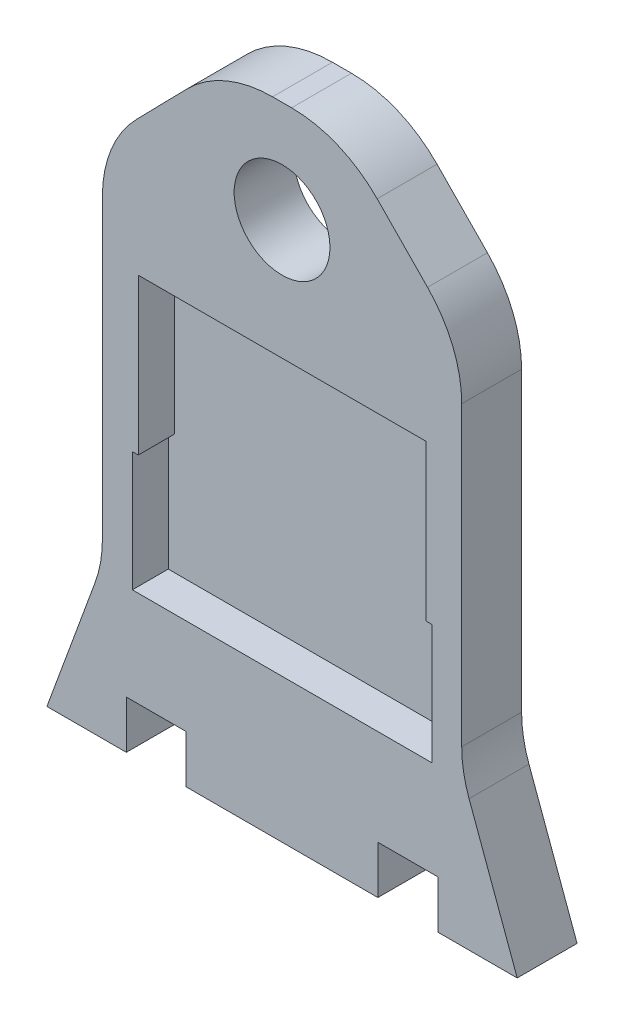
from build123d import *

# Parameters (mm, degrees)
ESQUISSE1_W             = 30
ESQUISSE1_H             = 67
ESQUISSE1_R             = 4
BOSS_EXTRU_1_DEPTH      = 5
ESQUISSE2_W             = 30
ESQUISSE2_H             = 12.5
ENL_V_MAT_EXTRU_1_DEPTH = 5
ESQUISSE3_W             = 5
ESQUISSE3_H             = 5
ENL_V_MAT_EXTRU_2_DEPTH = 38.043892884
BOSS_EXTRU_2_DEPTH      = 5
ENL_V_MAT_EXTRU_3_DEPTH = 40.33509883
ESQUISSE8_W             = 41.113396405
ESQUISSE8_H             = 1
ENL_V_MAT_EXTRU_4_DEPTH = 40.33509883
CONG_1_R                = 10
CONG_2_R                = 10
ESQUISSE9_W             = 24
ESQUISSE9_H             = 13
ENL_V_MAT_EXTRU_5_DEPTH = 3


with BuildPart() as part:
    # Esquisse1 → Boss.-Extru.1 (new body)
    with BuildSketch(Plane.XY):
        Rectangle(ESQUISSE1_W, ESQUISSE1_H)
        with Locations((0, 12.5)):
            Circle(ESQUISSE1_R, mode=Mode.SUBTRACT)
    extrude(amount=BOSS_EXTRU_1_DEPTH)

    # Esquisse2 → Enlèv. mat.-Extru.1 (cut)
    with BuildSketch(Plane.XY.offset(5)):
        with Locations((0, 27.25)):
            Rectangle(ESQUISSE2_W, ESQUISSE2_H)
    extrude(amount=-ENL_V_MAT_EXTRU_1_DEPTH, mode=Mode.SUBTRACT)

    # Esquisse3 → Enlèv. mat.-Extru.2 (cut, through all)
    with BuildSketch(Plane.XY.offset(5)):
        with Locations((-10.5, -31)):
            Rectangle(ESQUISSE3_W, ESQUISSE3_H)
        with Locations((10.5, -31)):
            Rectangle(ESQUISSE3_W, ESQUISSE3_H)
    extrude(amount=-ENL_V_MAT_EXTRU_2_DEPTH, mode=Mode.SUBTRACT)

    # Esquisse5 → Boss.-Extru.2 (add)
    with BuildSketch(Plane.XY.offset(5)):
        Polygon((-15, -19.875), (-20, -33.5), (-15, -33.5), align=None)
        Polygon((15, -19.875), (20, -33.5), (15, -33.5), align=None)
    extrude(amount=-BOSS_EXTRU_2_DEPTH)

    # Esquisse6 → Enlèv. mat.-Extru.3 (cut, through all)
    with BuildSketch(Plane.XY.offset(5)):
        Polygon((-15, 10.78125), (-5, 21), (-15, 21), align=None)
        Polygon((15, 10.78125), (5, 21), (15, 21), align=None)
    extrude(amount=-ENL_V_MAT_EXTRU_3_DEPTH, mode=Mode.SUBTRACT)

    # Esquisse8 → Enlèv. mat.-Extru.4 (cut, through all)
    with BuildSketch(Plane.XY.offset(5)):
        with Locations((0.556698202, -33)):
            Rectangle(ESQUISSE8_W, ESQUISSE8_H)
    extrude(amount=-ENL_V_MAT_EXTRU_4_DEPTH, mode=Mode.SUBTRACT)

    # Congé1
    cong_1_edges = [part.edges().sort_by_distance(p)[0] for p in [
        (-15, 10.78125, 2.5),
        (-5, 21, 2.5),
        (15, 10.78125, 2.5),
        (5, 21, 2.5),
    ]]
    fillet(cong_1_edges, radius=CONG_1_R)

    # Congé2
    cong_2_edges = [part.edges().sort_by_distance(p)[0] for p in [
        (-15, -19.875, 2.5),
        (15, -19.875, 2.5),
    ]]
    fillet(cong_2_edges, radius=CONG_2_R)

    # Esquisse9 → Enlèv. mat.-Extru.5 (cut)
    with BuildSketch(Plane.XY.offset(5)):
        with Locations((0, -4)):
            Rectangle(ESQUISSE9_W, ESQUISSE9_H)
        Polygon((12, -10.5), (-12, -10.5), (-12.5, -10.5), (-12.5, -20.5), (12.5, -20.5), (12.5, -10.5), align=None)
    extrude(amount=-ENL_V_MAT_EXTRU_5_DEPTH, mode=Mode.SUBTRACT)


solid = part.part
